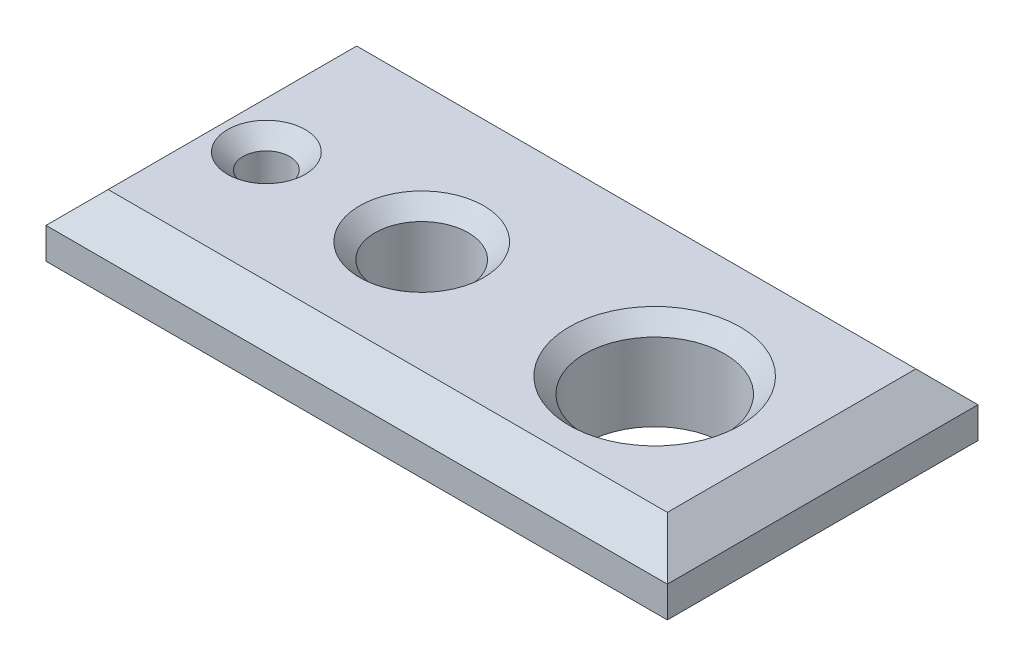
from build123d import *

# Parameters (mm, degrees)
SKETCH2_W           = 200
SKETCH2_H           = 100
SKETCH2_R           = 7.5
SKETCH2_R_2         = 15
SKETCH2_R_3         = 22.5
BOSS_EXTRUDE1_DEPTH = 30
CHAMFER2_SIZE       = 5
CHAMFER3_SIZE       = 10


with BuildPart() as part:
    # Sketch2 → Boss-Extrude1 (new body)
    with BuildSketch(Plane(origin=(0, 0, 0), x_dir=(1, 0, 0), z_dir=(0, 1, 0))):
        with Locations((0, 4.069144857)):
            Rectangle(SKETCH2_W, SKETCH2_H)
        with Locations(Location((-75, 0, 0), (0, 0, 270))):
            Circle(SKETCH2_R, mode=Mode.SUBTRACT)
        with Locations(Location((-25, 0, 0), (0, 0, 270))):
            Circle(SKETCH2_R_2, mode=Mode.SUBTRACT)
        with Locations(Location((50, 0, 0), (0, 0, 270))):
            Circle(SKETCH2_R_3, mode=Mode.SUBTRACT)
    extrude(amount=BOSS_EXTRUDE1_DEPTH)

    # Chamfer2
    chamfer2_edges = [part.edges().sort_by_distance(p)[0] for p in [
        (-75, 30, -7.5),
        (-25, 30, -15),
        (50, 30, -22.5),
    ]]
    chamfer(chamfer2_edges, length=CHAMFER2_SIZE)

    # Chamfer3
    chamfer3_edges = [part.edges().sort_by_distance(p)[0] for p in [
        (100, 30, -4.069144857),
        (0, 30, -54.069144857),
        (-100, 30, -4.069144857),
        (0, 0, -54.069144857),
        (100, 0, -4.069144857),
        (0, 0, 45.930855143),
        (-100, 0, -4.069144857),
        (0, 30, 45.930855143),
    ]]
    chamfer(chamfer3_edges, length=CHAMFER3_SIZE)


solid = part.part
